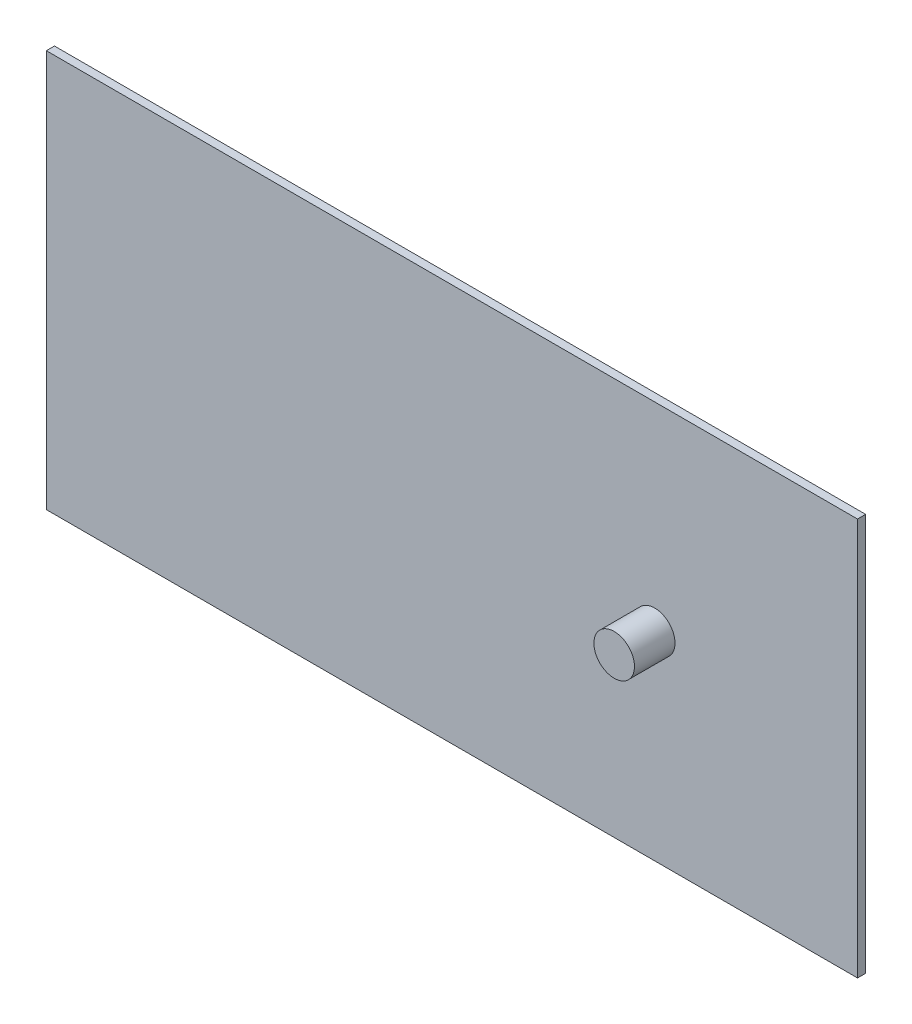
from build123d import *

# Parameters (mm, degrees)
SKETCH_1_W      = 200
SKETCH_1_H      = 98
EXTRUDE_1_DEPTH = 2
SKETCH_2_R      = 5
EXTRUDE_2_DEPTH = 10


with BuildPart() as part:
    # 草图1 → 凸台-拉伸1 (new body)
    with BuildSketch(Plane.XY):
        Rectangle(SKETCH_1_W, SKETCH_1_H)
    extrude(amount=EXTRUDE_1_DEPTH)

    # 草图2 → 凸台-拉伸2 (add)
    with BuildSketch(Plane.XY.offset(2)):
        with Locations(Location((50, 0, 0), (0, 0, 180))):
            Circle(SKETCH_2_R)
    extrude(amount=EXTRUDE_2_DEPTH)


solid = part.part
